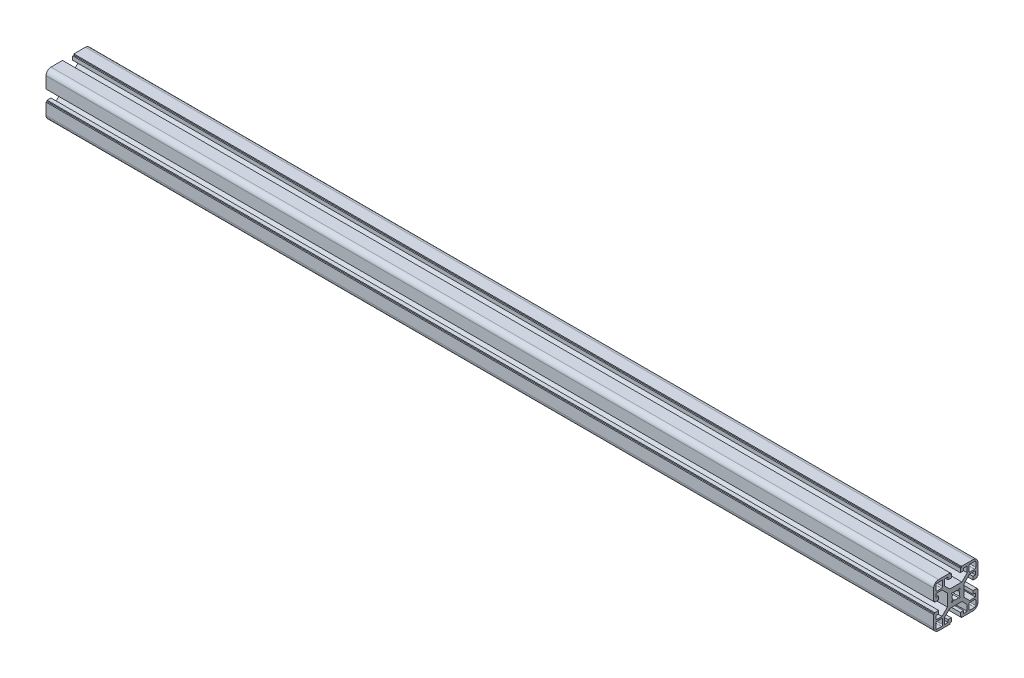
from build123d import *

# Parameters (mm, degrees)
EXTRUDE_1_DEPTH     = 50
EXTRUDE_2_DEPTH     = 800
CUT_EXTRUDE_START   = -19.72004
SKETCH_3_R          = 3
CUT_EXTRUDE_1_DEPTH = 40


with BuildPart() as part:
    # 草图1 → 凸台-拉伸1 (new body)
    with BuildSketch(Plane(origin=(0, 0, 0), x_dir=(0, 0, -1), z_dir=(1, 0, 0))):
        with BuildLine():
            Line((4.82004008, 19.27995992), (3.82004008, 19.27995992))
            Line((3.82004008, 19.27995992), (3.82004008, 15.77995992))
            Line((3.82004008, 15.77995992), (6.73639159, 15.77995992))
            Line((6.73639159, 15.77995992), (6.73639159, 18.02995992))
            Line((6.73639159, 18.02995992), (10.02004008, 18.02995992))
            Line((10.02004008, 18.02995992), (10.02004008, 12.70128026))
            Line((10.02004008, 12.70128026), (5.19871974, 7.87995992))
            Line((5.19871974, 7.87995992), (-5.75863958, 7.87995992))
            Line((-5.75863958, 7.87995992), (-10.57995992, 12.70128026))
            Line((-10.57995992, 12.70128026), (-10.57995992, 18.02995992))
            Line((-10.57995992, 18.02995992), (-7.29631143, 18.02995992))
            Line((-7.29631143, 18.02995992), (-7.29631143, 15.77995992))
            Line((-7.29631143, 15.77995992), (-4.37995992, 15.77995992))
            Line((-4.37995992, 15.77995992), (-4.37995992, 19.27995992))
            Line((-4.37995992, 19.27995992), (-5.37995992, 19.27995992))
            Line((-5.37995992, 19.27995992), (-5.37995992, 20.27995992))
            Line((-5.37995992, 20.27995992), (-15.77995992, 20.27995992))
            ThreePointArc((-15.77995992, 20.27995992), (-18.961940435, 18.961940435), (-20.27995992, 15.77995992))
            Line((-20.27995992, 15.77995992), (-20.27995992, 5.37995992))
            Line((-20.27995992, 5.37995992), (-19.27995992, 5.37995992))
            Line((-19.27995992, 5.37995992), (-19.27995992, 4.37995992))
            Line((-19.27995992, 4.37995992), (-15.77995992, 4.37995992))
            Line((-15.77995992, 4.37995992), (-15.77995992, 7.29631143))
            Line((-15.77995992, 7.29631143), (-18.02995992, 7.29631143))
            Line((-18.02995992, 7.29631143), (-18.02995992, 10.57995992))
            Line((-18.02995992, 10.57995992), (-12.70128026, 10.57995992))
            Line((-12.70128026, 10.57995992), (-7.87995992, 5.75863958))
            Line((-7.87995992, 5.75863958), (-7.87995992, -5.19871974))
            Line((-7.87995992, -5.19871974), (-12.70128026, -10.02004008))
            Line((-12.70128026, -10.02004008), (-18.02995992, -10.02004008))
            Line((-18.02995992, -10.02004008), (-18.02995992, -6.73639159))
            Line((-18.02995992, -6.73639159), (-15.77995992, -6.73639159))
            Line((-15.77995992, -6.73639159), (-15.77995992, -3.82004008))
            Line((-15.77995992, -3.82004008), (-19.27995992, -3.82004008))
            Line((-19.27995992, -3.82004008), (-19.27995992, -4.82004008))
            Line((-19.27995992, -4.82004008), (-20.27995992, -4.82004008))
            Line((-20.27995992, -4.82004008), (-20.27995992, -15.22004008))
            ThreePointArc((-20.27995992, -15.22004008), (-18.961940435, -18.402020595), (-15.77995992, -19.72004008))
            Line((-15.77995992, -19.72004008), (-5.37995992, -19.72004008))
            Line((-5.37995992, -19.72004008), (-5.37995992, -18.72004008))
            Line((-5.37995992, -18.72004008), (-4.37995992, -18.72004008))
            Line((-4.37995992, -18.72004008), (-4.37995992, -15.22004008))
            Line((-4.37995992, -15.22004008), (-7.29631143, -15.22004008))
            Line((-7.29631143, -15.22004008), (-7.29631143, -17.47004008))
            Line((-7.29631143, -17.47004008), (-10.57995992, -17.47004008))
            Line((-10.57995992, -17.47004008), (-10.57995992, -12.14136042))
            Line((-10.57995992, -12.14136042), (-5.75863958, -7.32004008))
            Line((-5.75863958, -7.32004008), (5.19871974, -7.32004008))
            Line((5.19871974, -7.32004008), (10.02004008, -12.14136042))
            Line((10.02004008, -12.14136042), (10.02004008, -17.47004008))
            Line((10.02004008, -17.47004008), (6.73639159, -17.47004008))
            Line((6.73639159, -17.47004008), (6.73639159, -15.22004008))
            Line((6.73639159, -15.22004008), (3.82004008, -15.22004008))
            Line((3.82004008, -15.22004008), (3.82004008, -18.72004008))
            Line((3.82004008, -18.72004008), (4.82004008, -18.72004008))
            Line((4.82004008, -18.72004008), (4.82004008, -19.72004008))
            Line((4.82004008, -19.72004008), (15.22004008, -19.72004008))
            ThreePointArc((15.22004008, -19.72004008), (18.402020595, -18.402020595), (19.72004008, -15.22004008))
            Line((19.72004008, -15.22004008), (19.72004008, -4.82004008))
            Line((19.72004008, -4.82004008), (18.72004008, -4.82004008))
            Line((18.72004008, -4.82004008), (18.72004008, -3.82004008))
            Line((18.72004008, -3.82004008), (15.22004008, -3.82004008))
            Line((15.22004008, -3.82004008), (15.22004008, -6.73639159))
            Line((15.22004008, -6.73639159), (17.47004008, -6.73639159))
            Line((17.47004008, -6.73639159), (17.47004008, -10.02004008))
            Line((17.47004008, -10.02004008), (12.14136042, -10.02004008))
            Line((12.14136042, -10.02004008), (7.32004008, -5.19871974))
            Line((7.32004008, -5.19871974), (7.32004008, 5.75863958))
            Line((7.32004008, 5.75863958), (12.14136042, 10.57995992))
            Line((12.14136042, 10.57995992), (17.47004008, 10.57995992))
            Line((17.47004008, 10.57995992), (17.47004008, 7.29631143))
            Line((17.47004008, 7.29631143), (15.22004008, 7.29631143))
            Line((15.22004008, 7.29631143), (15.22004008, 4.37995992))
            Line((15.22004008, 4.37995992), (18.72004008, 4.37995992))
            Line((18.72004008, 4.37995992), (18.72004008, 5.37995992))
            Line((18.72004008, 5.37995992), (19.72004008, 5.37995992))
            Line((19.72004008, 5.37995992), (19.72004008, 15.77995992))
            ThreePointArc((19.72004008, 15.77995992), (18.402020595, 18.961940435), (15.22004008, 20.27995992))
            Line((15.22004008, 20.27995992), (4.82004008, 20.27995992))
            Line((4.82004008, 20.27995992), (4.82004008, 19.27995992))
        make_face()
        with BuildLine():
            Line((-13.07995992, -17.72004008), (-17.27995992, -17.72004008))
            ThreePointArc((-17.27995992, -17.72004008), (-17.987066701, -17.427146861), (-18.27995992, -16.72004008))
            Line((-18.27995992, -16.72004008), (-18.27995992, -12.52004008))
            ThreePointArc((-18.27995992, -12.52004008), (-17.987066701, -11.812933299), (-17.27995992, -11.52004008))
            Line((-17.27995992, -11.52004008), (-13.07995992, -11.52004008))
            ThreePointArc((-13.07995992, -11.52004008), (-12.372853139, -11.812933299), (-12.07995992, -12.52004008))
            Line((-12.07995992, -12.52004008), (-12.07995992, -16.72004008))
            ThreePointArc((-12.07995992, -16.72004008), (-12.372853139, -17.427146861), (-13.07995992, -17.72004008))
        make_face(mode=Mode.SUBTRACT)
        with BuildLine():
            Line((-17.27995992, 18.27995992), (-13.07995992, 18.27995992))
            ThreePointArc((-13.07995992, 18.27995992), (-12.372853139, 17.987066701), (-12.07995992, 17.27995992))
            Line((-12.07995992, 17.27995992), (-12.07995992, 13.07995992))
            ThreePointArc((-12.07995992, 13.07995992), (-12.372853139, 12.372853139), (-13.07995992, 12.07995992))
            Line((-13.07995992, 12.07995992), (-17.27995992, 12.07995992))
            ThreePointArc((-17.27995992, 12.07995992), (-17.987066701, 12.372853139), (-18.27995992, 13.07995992))
            Line((-18.27995992, 13.07995992), (-18.27995992, 17.27995992))
            ThreePointArc((-18.27995992, 17.27995992), (-17.987066701, 17.987066701), (-17.27995992, 18.27995992))
        make_face(mode=Mode.SUBTRACT)
        with BuildLine():
            Line((16.72004008, 12.07995992), (12.52004008, 12.07995992))
            ThreePointArc((12.52004008, 12.07995992), (11.812933299, 12.372853139), (11.52004008, 13.07995992))
            Line((11.52004008, 13.07995992), (11.52004008, 17.27995992))
            ThreePointArc((11.52004008, 17.27995992), (11.812933299, 17.987066701), (12.52004008, 18.27995992))
            Line((12.52004008, 18.27995992), (16.72004008, 18.27995992))
            ThreePointArc((16.72004008, 18.27995992), (17.427146861, 17.987066701), (17.72004008, 17.27995992))
            Line((17.72004008, 17.27995992), (17.72004008, 13.07995992))
            ThreePointArc((17.72004008, 13.07995992), (17.427146861, 12.372853139), (16.72004008, 12.07995992))
        make_face(mode=Mode.SUBTRACT)
        with BuildLine():
            Line((3.75045895, -3.04335217), (3.04335217, -3.75045895))
            Line((3.04335217, -3.75045895), (1.74451108, -2.45161786))
            ThreePointArc((1.74451108, -2.45161786), (-0.27995992, -3.12004008), (-2.30443092, -2.45161786))
            Line((-2.30443092, -2.45161786), (-3.60327201, -3.75045895))
            Line((-3.60327201, -3.75045895), (-4.31037879, -3.04335217))
            Line((-4.31037879, -3.04335217), (-3.0115377, -1.74451108))
            ThreePointArc((-3.0115377, -1.74451108), (-3.67995992, 0.27995992), (-3.0115377, 2.30443092))
            Line((-3.0115377, 2.30443092), (-4.31037879, 3.60327201))
            Line((-4.31037879, 3.60327201), (-3.60327201, 4.31037879))
            Line((-3.60327201, 4.31037879), (-2.30443092, 3.0115377))
            ThreePointArc((-2.30443092, 3.0115377), (-0.27995992, 3.67995992), (1.74451108, 3.0115377))
            Line((1.74451108, 3.0115377), (3.04335217, 4.31037879))
            Line((3.04335217, 4.31037879), (3.75045895, 3.60327201))
            Line((3.75045895, 3.60327201), (2.45161786, 2.30443092))
            ThreePointArc((2.45161786, 2.30443092), (3.12004008, 0.27995992), (2.45161786, -1.74451108))
            Line((2.45161786, -1.74451108), (3.75045895, -3.04335217))
        make_face(mode=Mode.SUBTRACT)
        with BuildLine():
            Line((17.72004008, -12.52004008), (17.72004008, -16.72004008))
            ThreePointArc((17.72004008, -16.72004008), (17.427146861, -17.427146861), (16.72004008, -17.72004008))
            Line((16.72004008, -17.72004008), (12.52004008, -17.72004008))
            ThreePointArc((12.52004008, -17.72004008), (11.812933299, -17.427146861), (11.52004008, -16.72004008))
            Line((11.52004008, -16.72004008), (11.52004008, -12.52004008))
            ThreePointArc((11.52004008, -12.52004008), (11.812933299, -11.812933299), (12.52004008, -11.52004008))
            Line((12.52004008, -11.52004008), (16.72004008, -11.52004008))
            ThreePointArc((16.72004008, -11.52004008), (17.427146861, -11.812933299), (17.72004008, -12.52004008))
        make_face(mode=Mode.SUBTRACT)
    extrude(amount=-EXTRUDE_1_DEPTH)

    # 草图2 → 凸台-拉伸2 (add)
    with BuildSketch(Plane(origin=(0, 0, 0), x_dir=(0, 0, -1), z_dir=(1, 0, 0))):
        with BuildLine():
            Line((19.72004008, 5.37995992), (19.72004008, 15.77995992))
            ThreePointArc((19.72004008, 15.77995992), (18.402020595, 18.961940435), (15.22004008, 20.27995992))
            Line((15.22004008, 20.27995992), (4.82004008, 20.27995992))
            Line((4.82004008, 20.27995992), (4.82004008, 19.27995992))
            Line((4.82004008, 19.27995992), (3.82004008, 19.27995992))
            Line((3.82004008, 19.27995992), (3.82004008, 15.77995992))
            Line((3.82004008, 15.77995992), (6.73639159, 15.77995992))
            Line((6.73639159, 15.77995992), (6.73639159, 18.02995992))
            Line((6.73639159, 18.02995992), (10.02004008, 18.02995992))
            Line((10.02004008, 18.02995992), (10.02004008, 12.70128026))
            Line((10.02004008, 12.70128026), (5.19871974, 7.87995992))
            Line((5.19871974, 7.87995992), (-5.75863958, 7.87995992))
            Line((-5.75863958, 7.87995992), (-10.57995992, 12.70128026))
            Line((-10.57995992, 12.70128026), (-10.57995992, 18.02995992))
            Line((-10.57995992, 18.02995992), (-7.29631143, 18.02995992))
            Line((-7.29631143, 18.02995992), (-7.29631143, 15.77995992))
            Line((-7.29631143, 15.77995992), (-4.37995992, 15.77995992))
            Line((-4.37995992, 15.77995992), (-4.37995992, 19.27995992))
            Line((-4.37995992, 19.27995992), (-5.37995992, 19.27995992))
            Line((-5.37995992, 19.27995992), (-5.37995992, 20.27995992))
            Line((-5.37995992, 20.27995992), (-15.77995992, 20.27995992))
            ThreePointArc((-15.77995992, 20.27995992), (-18.961940435, 18.961940435), (-20.27995992, 15.77995992))
            Line((-20.27995992, 15.77995992), (-20.27995992, 5.37995992))
            Line((-20.27995992, 5.37995992), (-19.27995992, 5.37995992))
            Line((-19.27995992, 5.37995992), (-19.27995992, 4.37995992))
            Line((-19.27995992, 4.37995992), (-15.77995992, 4.37995992))
            Line((-15.77995992, 4.37995992), (-15.77995992, 7.29631143))
            Line((-15.77995992, 7.29631143), (-18.02995992, 7.29631143))
            Line((-18.02995992, 7.29631143), (-18.02995992, 10.57995992))
            Line((-18.02995992, 10.57995992), (-12.70128026, 10.57995992))
            Line((-12.70128026, 10.57995992), (-7.87995992, 5.75863958))
            Line((-7.87995992, 5.75863958), (-7.87995992, -5.19871974))
            Line((-7.87995992, -5.19871974), (-12.70128026, -10.02004008))
            Line((-12.70128026, -10.02004008), (-18.02995992, -10.02004008))
            Line((-18.02995992, -10.02004008), (-18.02995992, -6.73639159))
            Line((-18.02995992, -6.73639159), (-15.77995992, -6.73639159))
            Line((-15.77995992, -6.73639159), (-15.77995992, -3.82004008))
            Line((-15.77995992, -3.82004008), (-19.27995992, -3.82004008))
            Line((-19.27995992, -3.82004008), (-19.27995992, -4.82004008))
            Line((-19.27995992, -4.82004008), (-20.27995992, -4.82004008))
            Line((-20.27995992, -4.82004008), (-20.27995992, -15.22004008))
            ThreePointArc((-20.27995992, -15.22004008), (-18.961940435, -18.402020595), (-15.77995992, -19.72004008))
            Line((-15.77995992, -19.72004008), (-5.37995992, -19.72004008))
            Line((-5.37995992, -19.72004008), (-5.37995992, -18.72004008))
            Line((-5.37995992, -18.72004008), (-4.37995992, -18.72004008))
            Line((-4.37995992, -18.72004008), (-4.37995992, -15.22004008))
            Line((-4.37995992, -15.22004008), (-7.29631143, -15.22004008))
            Line((-7.29631143, -15.22004008), (-7.29631143, -17.47004008))
            Line((-7.29631143, -17.47004008), (-10.57995992, -17.47004008))
            Line((-10.57995992, -17.47004008), (-10.57995992, -12.14136042))
            Line((-10.57995992, -12.14136042), (-5.75863958, -7.32004008))
            Line((-5.75863958, -7.32004008), (5.19871974, -7.32004008))
            Line((5.19871974, -7.32004008), (10.02004008, -12.14136042))
            Line((10.02004008, -12.14136042), (10.02004008, -17.47004008))
            Line((10.02004008, -17.47004008), (6.73639159, -17.47004008))
            Line((6.73639159, -17.47004008), (6.73639159, -15.22004008))
            Line((6.73639159, -15.22004008), (3.82004008, -15.22004008))
            Line((3.82004008, -15.22004008), (3.82004008, -18.72004008))
            Line((3.82004008, -18.72004008), (4.82004008, -18.72004008))
            Line((4.82004008, -18.72004008), (4.82004008, -19.72004008))
            Line((4.82004008, -19.72004008), (15.22004008, -19.72004008))
            ThreePointArc((15.22004008, -19.72004008), (18.402020595, -18.402020595), (19.72004008, -15.22004008))
            Line((19.72004008, -15.22004008), (19.72004008, -4.82004008))
            Line((19.72004008, -4.82004008), (18.72004008, -4.82004008))
            Line((18.72004008, -4.82004008), (18.72004008, -3.82004008))
            Line((18.72004008, -3.82004008), (15.22004008, -3.82004008))
            Line((15.22004008, -3.82004008), (15.22004008, -6.73639159))
            Line((15.22004008, -6.73639159), (17.47004008, -6.73639159))
            Line((17.47004008, -6.73639159), (17.47004008, -10.02004008))
            Line((17.47004008, -10.02004008), (12.14136042, -10.02004008))
            Line((12.14136042, -10.02004008), (7.32004008, -5.19871974))
            Line((7.32004008, -5.19871974), (7.32004008, 5.75863958))
            Line((7.32004008, 5.75863958), (12.14136042, 10.57995992))
            Line((12.14136042, 10.57995992), (17.47004008, 10.57995992))
            Line((17.47004008, 10.57995992), (17.47004008, 7.29631143))
            Line((17.47004008, 7.29631143), (15.22004008, 7.29631143))
            Line((15.22004008, 7.29631143), (15.22004008, 4.37995992))
            Line((15.22004008, 4.37995992), (18.72004008, 4.37995992))
            Line((18.72004008, 4.37995992), (18.72004008, 5.37995992))
            Line((18.72004008, 5.37995992), (19.72004008, 5.37995992))
        make_face()
        with BuildLine():
            Line((-17.27995992, -17.72004008), (-13.07995992, -17.72004008))
            ThreePointArc((-13.07995992, -17.72004008), (-12.372853139, -17.427146861), (-12.07995992, -16.72004008))
            Line((-12.07995992, -16.72004008), (-12.07995992, -12.52004008))
            ThreePointArc((-12.07995992, -12.52004008), (-12.372853139, -11.812933299), (-13.07995992, -11.52004008))
            Line((-13.07995992, -11.52004008), (-17.27995992, -11.52004008))
            ThreePointArc((-17.27995992, -11.52004008), (-17.987066701, -11.812933299), (-18.27995992, -12.52004008))
            Line((-18.27995992, -12.52004008), (-18.27995992, -16.72004008))
            ThreePointArc((-18.27995992, -16.72004008), (-17.987066701, -17.427146861), (-17.27995992, -17.72004008))
        make_face(mode=Mode.SUBTRACT)
        with BuildLine():
            Line((-13.07995992, 18.27995992), (-17.27995992, 18.27995992))
            ThreePointArc((-17.27995992, 18.27995992), (-17.987066701, 17.987066701), (-18.27995992, 17.27995992))
            Line((-18.27995992, 17.27995992), (-18.27995992, 13.07995992))
            ThreePointArc((-18.27995992, 13.07995992), (-17.987066701, 12.372853139), (-17.27995992, 12.07995992))
            Line((-17.27995992, 12.07995992), (-13.07995992, 12.07995992))
            ThreePointArc((-13.07995992, 12.07995992), (-12.372853139, 12.372853139), (-12.07995992, 13.07995992))
            Line((-12.07995992, 13.07995992), (-12.07995992, 17.27995992))
            ThreePointArc((-12.07995992, 17.27995992), (-12.372853139, 17.987066701), (-13.07995992, 18.27995992))
        make_face(mode=Mode.SUBTRACT)
        with BuildLine():
            Line((11.52004008, 17.27995992), (11.52004008, 13.07995992))
            ThreePointArc((11.52004008, 13.07995992), (11.812933299, 12.372853139), (12.52004008, 12.07995992))
            Line((12.52004008, 12.07995992), (16.72004008, 12.07995992))
            ThreePointArc((16.72004008, 12.07995992), (17.427146861, 12.372853139), (17.72004008, 13.07995992))
            Line((17.72004008, 13.07995992), (17.72004008, 17.27995992))
            ThreePointArc((17.72004008, 17.27995992), (17.427146861, 17.987066701), (16.72004008, 18.27995992))
            Line((16.72004008, 18.27995992), (12.52004008, 18.27995992))
            ThreePointArc((12.52004008, 18.27995992), (11.812933299, 17.987066701), (11.52004008, 17.27995992))
        make_face(mode=Mode.SUBTRACT)
        with BuildLine():
            Line((11.52004008, -12.52004008), (11.52004008, -16.72004008))
            ThreePointArc((11.52004008, -16.72004008), (11.812933299, -17.427146861), (12.52004008, -17.72004008))
            Line((12.52004008, -17.72004008), (16.72004008, -17.72004008))
            ThreePointArc((16.72004008, -17.72004008), (17.427146861, -17.427146861), (17.72004008, -16.72004008))
            Line((17.72004008, -16.72004008), (17.72004008, -12.52004008))
            ThreePointArc((17.72004008, -12.52004008), (17.427146861, -11.812933299), (16.72004008, -11.52004008))
            Line((16.72004008, -11.52004008), (12.52004008, -11.52004008))
            ThreePointArc((12.52004008, -11.52004008), (11.812933299, -11.812933299), (11.52004008, -12.52004008))
        make_face(mode=Mode.SUBTRACT)
        with BuildLine():
            Line((-4.31037879, 3.60327201), (-3.0115377, 2.30443092))
            ThreePointArc((-3.0115377, 2.30443092), (-3.67995992, 0.27995992), (-3.0115377, -1.74451108))
            Line((-3.0115377, -1.74451108), (-4.31037879, -3.04335217))
            Line((-4.31037879, -3.04335217), (-3.60327201, -3.75045895))
            Line((-3.60327201, -3.75045895), (-2.30443092, -2.45161786))
            ThreePointArc((-2.30443092, -2.45161786), (-0.27995992, -3.12004008), (1.74451108, -2.45161786))
            Line((1.74451108, -2.45161786), (3.04335217, -3.75045895))
            Line((3.04335217, -3.75045895), (3.75045895, -3.04335217))
            Line((3.75045895, -3.04335217), (2.45161786, -1.74451108))
            ThreePointArc((2.45161786, -1.74451108), (3.12004008, 0.27995992), (2.45161786, 2.30443092))
            Line((2.45161786, 2.30443092), (3.75045895, 3.60327201))
            Line((3.75045895, 3.60327201), (3.04335217, 4.31037879))
            Line((3.04335217, 4.31037879), (1.74451108, 3.0115377))
            ThreePointArc((1.74451108, 3.0115377), (-0.27995992, 3.67995992), (-2.30443092, 3.0115377))
            Line((-2.30443092, 3.0115377), (-3.60327201, 4.31037879))
            Line((-3.60327201, 4.31037879), (-4.31037879, 3.60327201))
        make_face(mode=Mode.SUBTRACT)
    extrude(amount=-EXTRUDE_2_DEPTH)

    # 草图3 → 切除-拉伸1 (cut)
    with BuildSketch(Plane.XY.offset(CUT_EXTRUDE_START)):
        with Locations(Location((-371, 0.27995992, 0), (0, 0, 222.440458406))):
            Circle(SKETCH_3_R)
        with Locations(Location((-279, 0.27995992, 0), (0, 0, 222.440458406))):
            Circle(SKETCH_3_R)
        with Locations(Location((-521, 0.27995992, 0), (0, 0, 222.440458406))):
            Circle(SKETCH_3_R)
        with Locations(Location((-429, 0.27995992, 0), (0, 0, 222.440458406))):
            Circle(SKETCH_3_R)
    extrude(amount=CUT_EXTRUDE_1_DEPTH, mode=Mode.SUBTRACT)


solid = part.part
